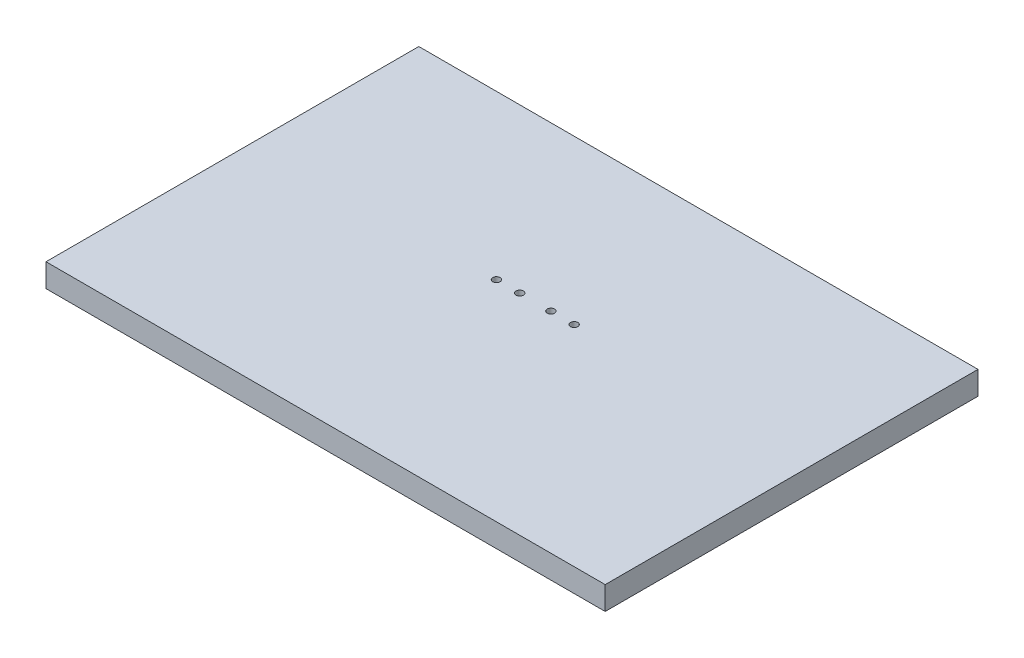
from build123d import *

# Parameters (mm, degrees)
SKETCH1_W           = 304.8
SKETCH1_H           = 203.2
BOSS_EXTRUDE1_DEPTH = 12.7
SKETCH2_R           = 2
CUT_EXTRUDE1_DEPTH  = 184.601770144


with BuildPart() as part:
    # Sketch1 → Boss-Extrude1 (new body)
    with BuildSketch(Plane(origin=(0, 0, 0), x_dir=(1, 0, 0), z_dir=(0, 1, 0))):
        Rectangle(SKETCH1_W, SKETCH1_H)
    extrude(amount=BOSS_EXTRUDE1_DEPTH)

    # Sketch2 → Cut-Extrude1 (cut, through all)
    with BuildSketch(Plane(origin=(0, 12.7, 0), x_dir=(1, 0, 0), z_dir=(0, 1, 0))):
        with Locations(Location((-21.2, 12.7, 0), (0, 0, 270))):
            Circle(SKETCH2_R)
        with Locations(Location((-8.5, 12.7, 0), (0, 0, 270))):
            Circle(SKETCH2_R)
        with Locations(Location((21.2, 12.7, 0), (0, 0, 90))):
            Circle(SKETCH2_R)
        with Locations(Location((8.5, 12.7, 0), (0, 0, 90))):
            Circle(SKETCH2_R)
    extrude(amount=-CUT_EXTRUDE1_DEPTH, mode=Mode.SUBTRACT)


solid = part.part
